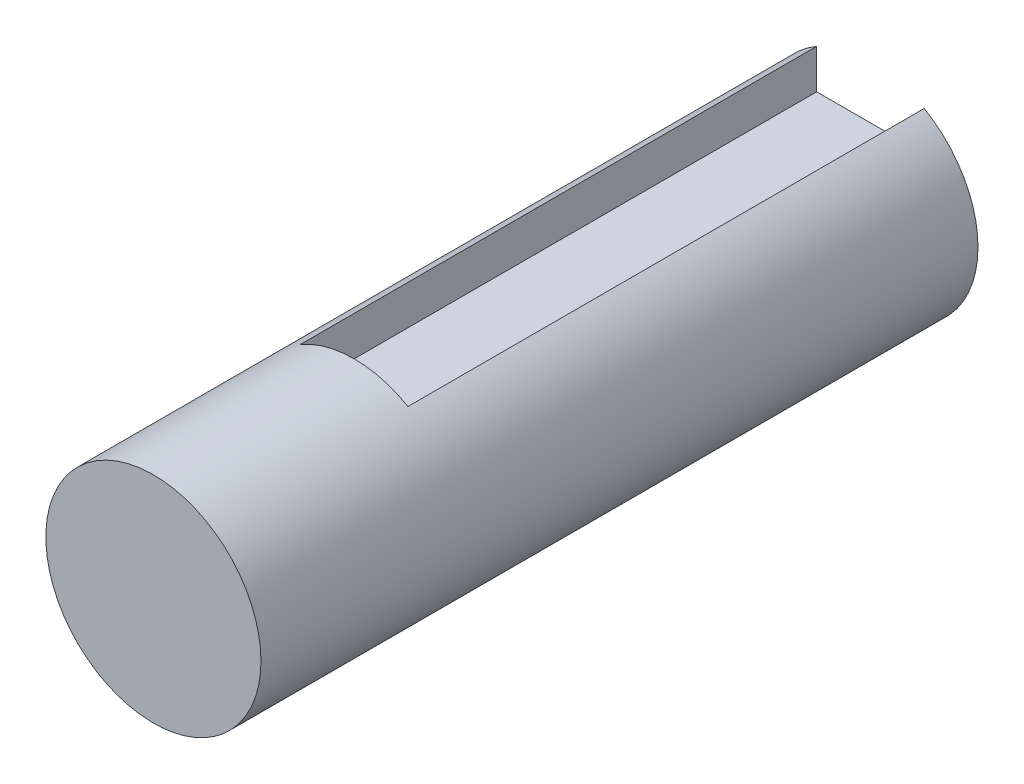
from build123d import *

# Parameters (mm, degrees)
SKETCH1_W          = 15
SKETCH1_H          = 100
CUT_EXTRUDE1_DEPTH = 72


with BuildPart() as part:
    # Sketch1 → Revolve1 (revolve)
    with BuildSketch(Plane(origin=(0, 0, 0), x_dir=(1, 0, 0), z_dir=(0, 1, 0))):
        with Locations((7.5, 22)):
            Rectangle(SKETCH1_W, SKETCH1_H)
    revolve(axis=Axis((0, 0, -72), (0, 0, 1)))

    # Sketch2 → Cut-Extrude1 (cut)
    with BuildSketch(Plane(origin=(0, 0, -72), x_dir=(-1, 0, 0), z_dir=(0, 0, -1))):
        with BuildLine():
            Line((-7.5, 12.990381057), (-7.5, 7.5))
            Line((-7.5, 7.5), (7.5, 7.5))
            Line((7.5, 7.5), (7.5, 12.990381057))
            ThreePointArc((7.5, 12.990381057), (0, 15), (-7.5, 12.990381057))
        make_face()
    extrude(amount=-CUT_EXTRUDE1_DEPTH, mode=Mode.SUBTRACT)


solid = part.part
